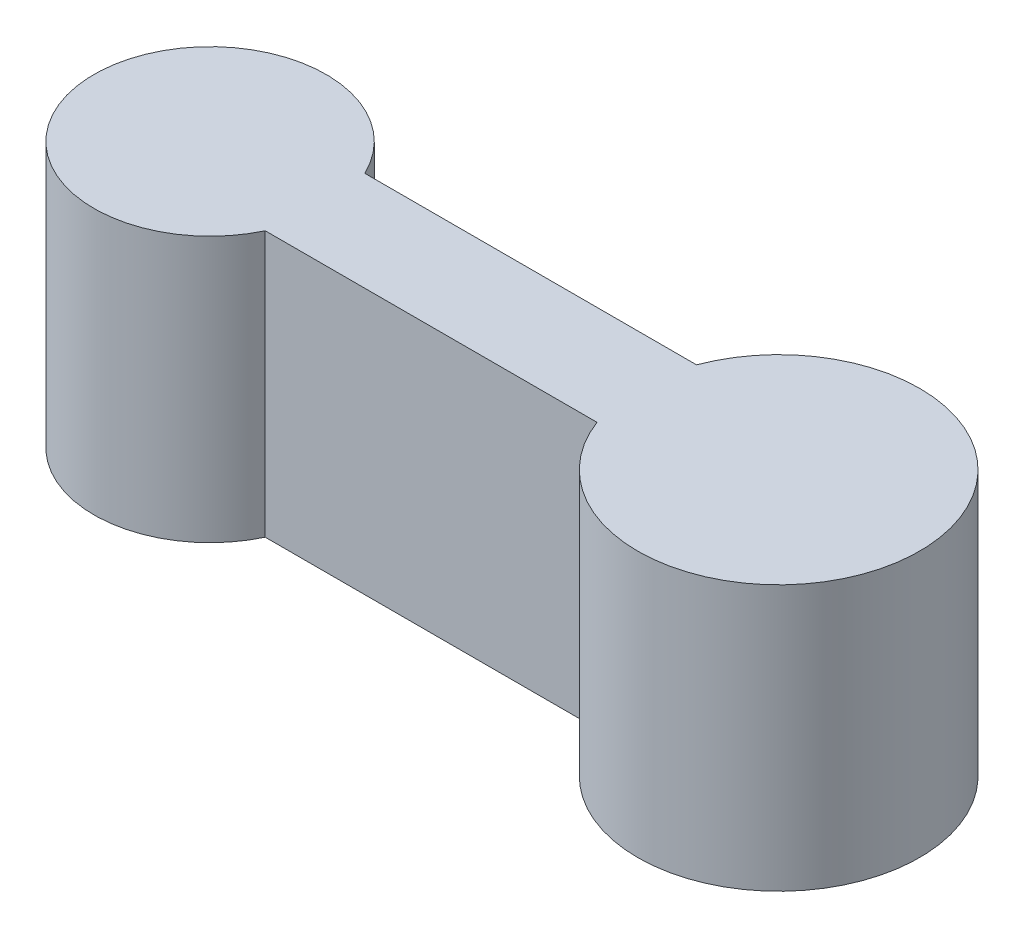
from build123d import *

# Parameters (mm, degrees)
BOSS_EXTRUDE1_DEPTH = 8


with BuildPart() as part:
    # Sketch1 → Boss-Extrude1 (new body)
    with BuildSketch(Plane(origin=(0, 0, 0), x_dir=(1, 0, 0), z_dir=(0, 1, 0))):
        with BuildLine():
            Line((-13.97649343, 1.5), (-3.97649343, 1.5))
            ThreePointArc((-3.97649343, 1.5), (4.25, 0), (-3.97649343, -1.5))
            Line((-3.97649343, -1.5), (-13.97649343, -1.5))
            ThreePointArc((-13.97649343, -1.5), (-20.63877109, 0), (-13.97649343, 1.5))
        make_face()
    extrude(amount=BOSS_EXTRUDE1_DEPTH)


solid = part.part
